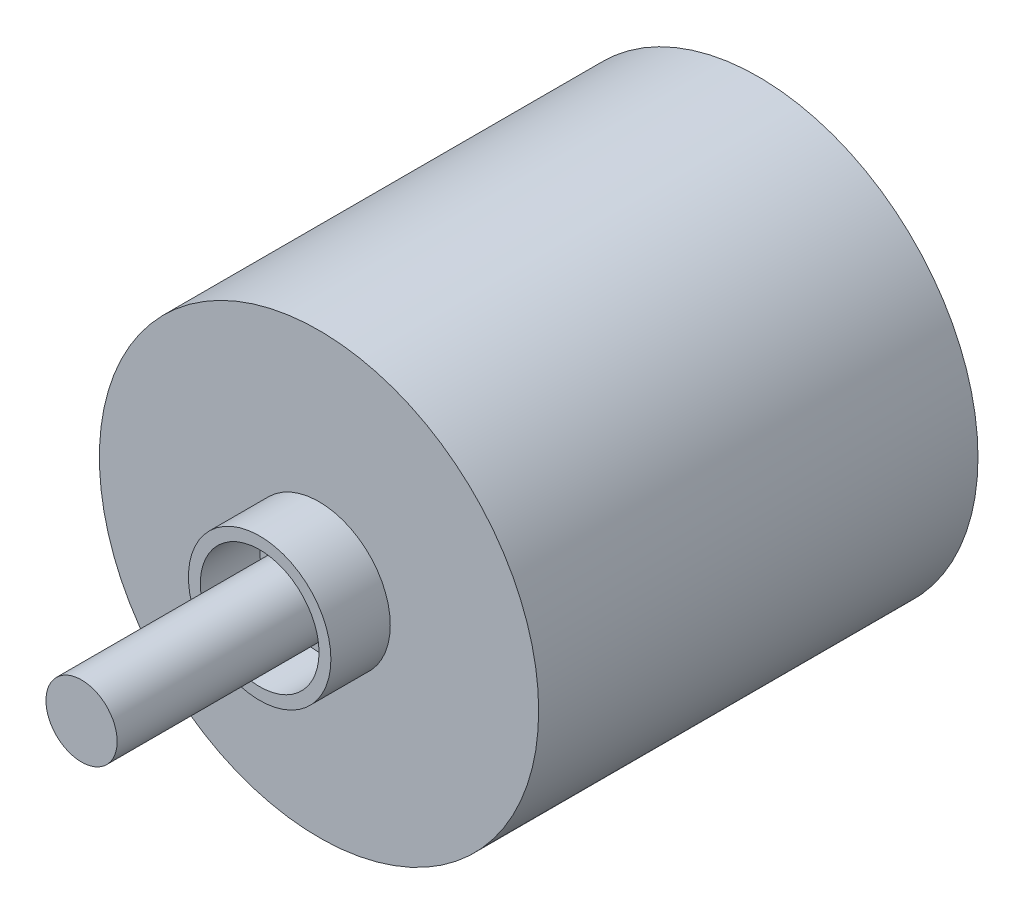
from build123d import *

# Parameters (mm, degrees)
CROQUIS1_R                       = 18.5
SALIENTE_EXTRUIR1_DEPTH          = 37
CROQUIS2_R                       = 6
CROQUIS2_R_2                     = 5
SALIENTE_EXTRUIR2_DEPTH          = 5
CROQUIS2_3_R                     = 3
SALIENTE_EXTRUIR3_DEPTH          = 20
TALADRO_DE_MARGEN_PARA_M31_D     = 3.4
TALADRO_DE_MARGEN_PARA_M31_DEPTH = 5


with BuildPart() as part:
    # Croquis1 → Saliente-Extruir1 (new body)
    with BuildSketch(Plane.XY):
        Circle(CROQUIS1_R)
    extrude(amount=SALIENTE_EXTRUIR1_DEPTH)

    # Croquis2 → Saliente-Extruir2 (add)
    with BuildSketch(Plane.XY.offset(37)):
        Circle(CROQUIS2_R)
        Circle(CROQUIS2_R_2, mode=Mode.SUBTRACT)
    extrude(amount=SALIENTE_EXTRUIR2_DEPTH)

    # Croquis2<3> → Saliente-Extruir3 (add)
    with BuildSketch(Plane.XY.offset(37)):
        Circle(CROQUIS2_3_R)
    extrude(amount=SALIENTE_EXTRUIR3_DEPTH)

    # Taladro de margen para M31
    with Locations(Plane(origin=(0, 0, 0), x_dir=(-1, 0, 0), z_dir=(0, 0, -1))):
        with Locations((0, 15.5), (13.423393759, 7.75), (13.423393759, -7.75), (0, -15.5), (-13.423393759, -7.75), (-13.423393759, 7.75)):
            Hole(TALADRO_DE_MARGEN_PARA_M31_D / 2, depth=TALADRO_DE_MARGEN_PARA_M31_DEPTH)


solid = part.part
